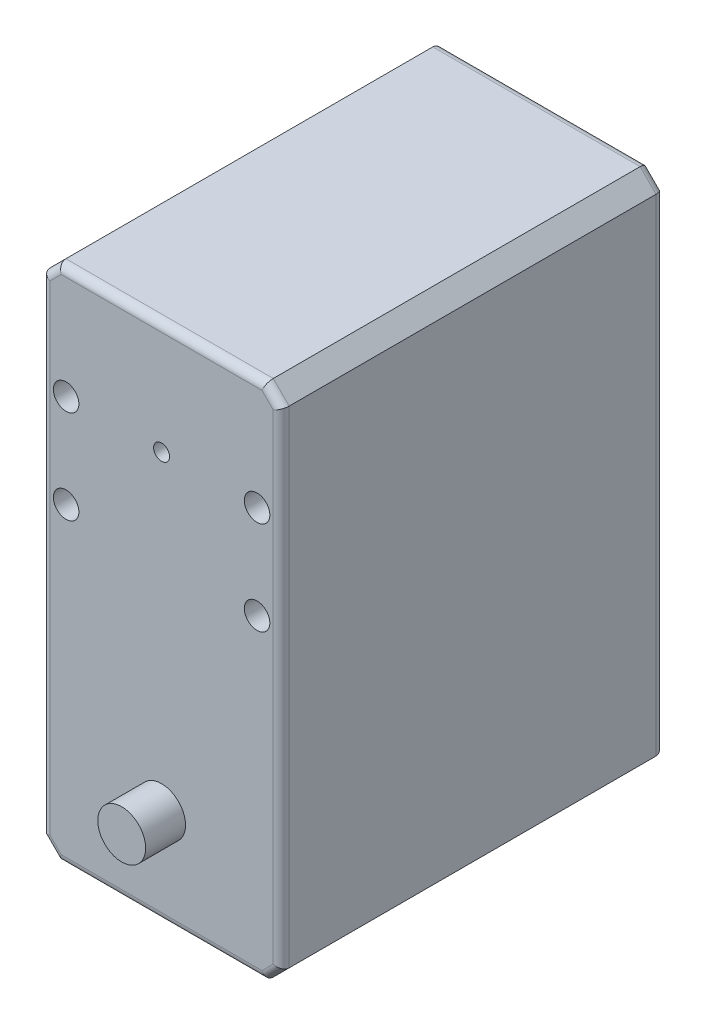
from build123d import *

# Parameters (mm, degrees)
SKETCH_1_W           = 30
SKETCH_1_H           = 65
EXTRUDE_1_DEPTH      = 48
SKETCH_2_R           = 1
CUT_EXTRUDE_1_DEPTH  = 48
EXTRUDE_2_DEPTH      = 5
EXTRUDE_2_DEPTH_BACK = 53
SKETCH_3_R           = 3
CHAMFER_1_SIZE       = 2
FILLET_1_R           = 1
FILLET_2_R           = 1
SKETCH_6_R           = 1.6
SKETCH_6_R_2         = 1
CUT_EXTRUDE_3_DEPTH  = 76


with BuildPart() as part:
    # ｽｹｯﾁ1 → ﾎﾞｽ - 押し出し1 (new body)
    with BuildSketch(Plane.XY):
        with Locations((44.026916893, 39.150883092)):
            Rectangle(SKETCH_1_W, SKETCH_1_H)
    extrude(amount=EXTRUDE_1_DEPTH)

    # ｽｹｯﾁ2 → ｶｯﾄ - 押し出し1 (cut)
    with BuildSketch(Plane.XY):
        with Locations((56.026916893, 57.650883092)):
            Circle(SKETCH_2_R)
        with Locations((32.026916893, 57.650883092)):
            Circle(SKETCH_2_R)
        with Locations((44.026916893, 57.650883092)):
            Circle(SKETCH_2_R)
        with Locations((56.023819064, 45.923533591)):
            Circle(SKETCH_2_R)
        with Locations((32.030014722, 45.923533591)):
            Circle(SKETCH_2_R)
    extrude(amount=CUT_EXTRUDE_1_DEPTH, mode=Mode.SUBTRACT)

    # ｽｹｯﾁ3 → ﾎﾞｽ - 押し出し2 (add, two sides: drawn at the far end of the back side and taken through both)
    with BuildSketch(Plane(origin=(0, 0, 0), x_dir=(-1, 0, 0), z_dir=(0, 0, -1)).offset(-EXTRUDE_2_DEPTH_BACK)):
        with Locations((-44.026916893, 18.650883092)):
            Circle(SKETCH_3_R)
    extrude(amount=EXTRUDE_2_DEPTH + EXTRUDE_2_DEPTH_BACK)

    # 面取り1
    chamfer_1_edges = [part.edges().sort_by_distance(p)[0] for p in [
        (29.026916893, 6.650883092, 24),
        (59.026916893, 6.650883092, 24),
        (59.026916893, 71.650883092, 24),
        (29.026916893, 71.650883092, 24),
    ]]
    chamfer(chamfer_1_edges, length=CHAMFER_1_SIZE)

    # ﾌｨﾚｯﾄ1
    fillet_1_edges = [part.edges().sort_by_distance(p)[0] for p in [
        (30.026916893, 70.650883092, 48),
        (44.026916893, 71.650883092, 48),
        (58.026916893, 70.650883092, 48),
        (29.026916893, 39.150883092, 48),
        (30.026916893, 7.650883092, 48),
        (44.026916893, 6.650883092, 48),
        (58.026916893, 7.650883092, 48),
        (59.026916893, 39.150883092, 48),
    ]]
    fillet(fillet_1_edges, radius=FILLET_1_R)

    # ﾌｨﾚｯﾄ2
    fillet_2_edges = [part.edges().sort_by_distance(p)[0] for p in [
        (58.026916893, 70.650883092, 0),
        (30.026916893, 70.650883092, 0),
        (44.026916893, 71.650883092, 0),
        (29.026916893, 39.150883092, 0),
        (30.026916893, 7.650883092, 0),
        (44.026916893, 6.650883092, 0),
        (58.026916893, 7.650883092, 0),
        (59.026916893, 39.150883092, 0),
    ]]
    fillet(fillet_2_edges, radius=FILLET_2_R)

    # ｽｹｯﾁ6 → ｶｯﾄ - 押し出し3 (cut)
    # profile 1 of 4: a face of its own
    with BuildSketch(Plane(origin=(0, 0, 0), x_dir=(-1, 0, 0), z_dir=(0, 0, -1))):
        with Locations((-55.99912174, 45.879603206)):
            Circle(SKETCH_6_R)
        with Locations((-56.023819064, 45.923533591)):
            Circle(SKETCH_6_R_2, mode=Mode.SUBTRACT)
    # profile 2 of 4: a face of its own
    with BuildSketch(Plane(origin=(0, 0, 0), x_dir=(-1, 0, 0), z_dir=(0, 0, -1))):
        with Locations((-32.054712046, 45.967463976)):
            Circle(SKETCH_6_R)
    # profile 3 of 4: a face of its own
    with BuildSketch(Plane(origin=(0, 0, 0), x_dir=(-1, 0, 0), z_dir=(0, 0, -1))):
        with Locations((-55.99912174, 57.606952707)):
            Circle(SKETCH_6_R)
    # profile 4 of 4: a face of its own
    with BuildSketch(Plane(origin=(0, 0, 0), x_dir=(-1, 0, 0), z_dir=(0, 0, -1))):
        with Locations((-32.054712046, 57.694813478)):
            Circle(SKETCH_6_R)
    extrude(amount=-CUT_EXTRUDE_3_DEPTH, mode=Mode.SUBTRACT)


solid = part.part
